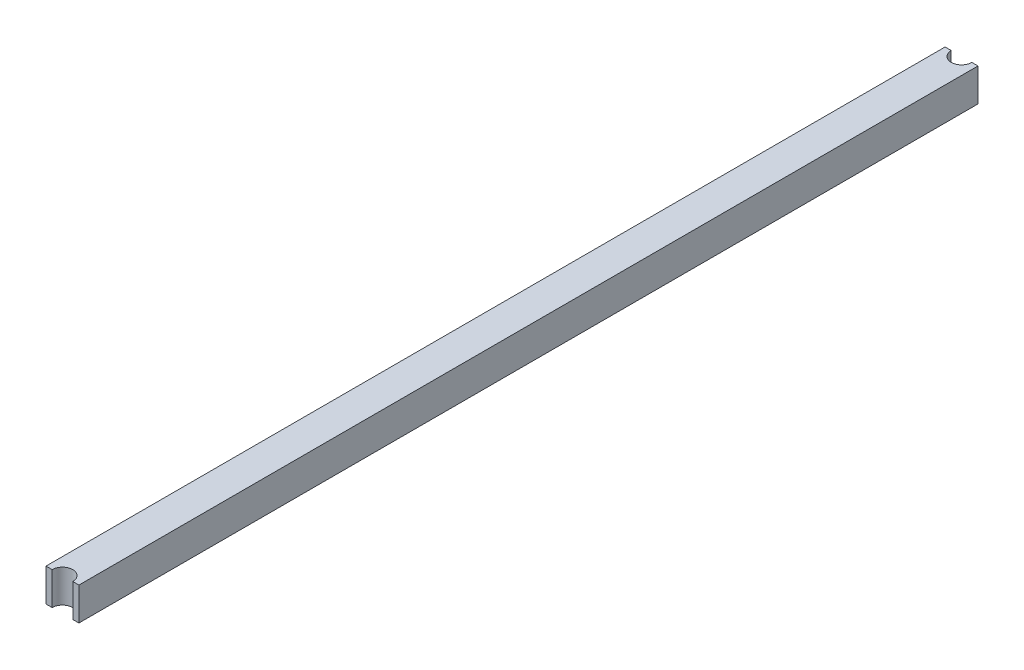
from build123d import *

# Parameters (mm, degrees)
SKETCH1_W           = 31.1
SKETCH1_H           = 31.1
BOSS_EXTRUDE1_DEPTH = 850
SKETCH2_R           = 9.755
CUT_EXTRUDE1_DEPTH  = 31.1


with BuildPart() as part:
    # Sketch1 → Boss-Extrude1 (new body)
    with BuildSketch(Plane.XY):
        with Locations((-15.55, 15.55)):
            Rectangle(SKETCH1_W, SKETCH1_H)
    extrude(amount=BOSS_EXTRUDE1_DEPTH)

    # Sketch2 → Cut-Extrude1 (cut)
    with BuildSketch(Plane(origin=(0, 31.1, 0), x_dir=(1, 0, 0), z_dir=(0, 1, 0))):
        with Locations((-15.55, 0)):
            Circle(SKETCH2_R)
        with Locations((-15.55, -850)):
            Circle(SKETCH2_R)
    extrude(amount=-CUT_EXTRUDE1_DEPTH, mode=Mode.SUBTRACT)


solid = part.part
